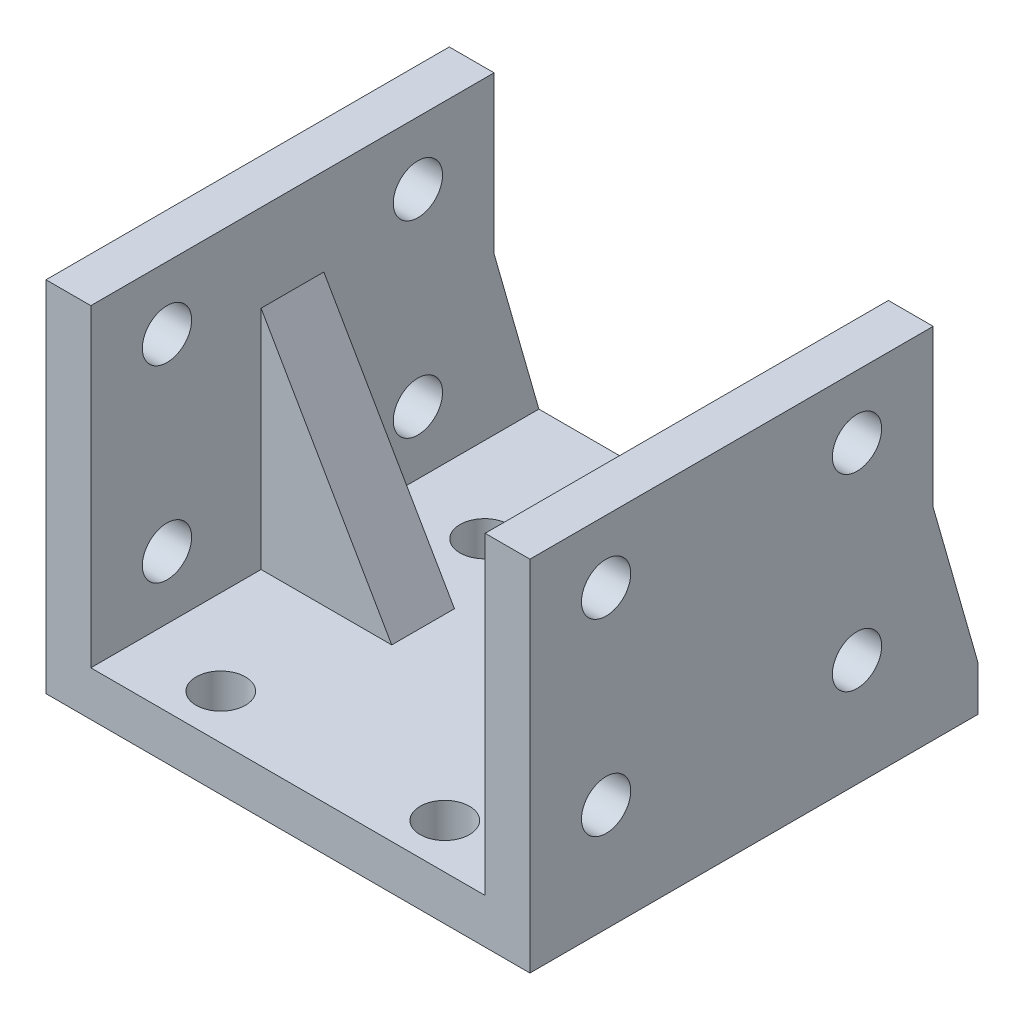
from build123d import *

# Parameters (mm, degrees)
SKETCH1_W               = 54
SKETCH1_H               = 55
BOSS_EXTRUDE1_DEPTH     = 5
SKETCH6_W               = 5
SKETCH6_H               = 45
BOSS_EXTRUDE3_DEPTH     = 35
SKETCH7_R               = 2.75
CUT_EXTRUDE2_DEPTH      = 69.972820734
RIB1_REACH              = 74.61
SKETCH8_WALL_W          = 165.420796688
SKETCH8_WALL_H          = 5
MIRROR2_COPY_1_REACH    = 74.61
MIRROR2_COPY_1_SKETCH_W = 165.420796688
MIRROR2_COPY_1_SKETCH_H = 5
RIB4_REACH              = 57.545
SKETCH9_WALL_W          = 142.246242154
SKETCH9_WALL_H          = 7
SKETCH10_R              = 2.75
CUT_EXTRUDE3_DEPTH      = 53.060061468
SKETCH11_W              = 54
SKETCH11_H              = 5
CUT_EXTRUDE4_DEPTH      = 40


with BuildPart() as part:
    # Sketch1 → Boss-Extrude1 (new body)
    with BuildSketch(Plane(origin=(0, 0, 0), x_dir=(1, 0, 0), z_dir=(0, 1, 0))):
        Rectangle(SKETCH1_W, SKETCH1_H)
    extrude(amount=BOSS_EXTRUDE1_DEPTH)

    # Sketch6 → Boss-Extrude3 (add)
    with BuildSketch(Plane(origin=(0, 5, 0), x_dir=(1, 0, 0), z_dir=(0, 1, 0))):
        with Locations((-24.5, 0)):
            Rectangle(SKETCH6_W, SKETCH6_H)
    boss_extrude3 = extrude(amount=BOSS_EXTRUDE3_DEPTH)

    # Sketch7 → Cut-Extrude2 (cut, through all)
    with BuildSketch(Plane(origin=(-22, 0, 0), x_dir=(0, 0, -1), z_dir=(1, 0, 0))):
        with Locations((-14, 33)):
            Circle(SKETCH7_R)
        with Locations((14, 33)):
            Circle(SKETCH7_R)
        with Locations((14, 12)):
            Circle(SKETCH7_R)
        with Locations((-14, 12)):
            Circle(SKETCH7_R)
    cut_extrude2 = extrude(amount=-CUT_EXTRUDE2_DEPTH, mode=Mode.SUBTRACT)

    # Sketch8 wall → Rib1 (add, up to next)
    with BuildSketch(Plane(origin=(-27, 13.75, -25), x_dir=(0, -0.961523947641, -0.274721127897), z_dir=(0, -0.274721127897, 0.961523947641)), mode=Mode.PRIVATE) as rib1_sk1:
        with Locations((0, 2.5)):
            Rectangle(SKETCH8_WALL_W, SKETCH8_WALL_H)
    rib1_tool1 = extrude(rib1_sk1.sketch, amount=RIB1_REACH, mode=Mode.PRIVATE) - part.part
    rib1 = rib1_tool1.solids().sort_by_distance((-27, 13.75, -25))[0]
    add(rib1)

    # Mirror1: Rib1 across plane
    add(rib1.mirror(Plane.XY))

    # Mirror2: Boss-Extrude3, Cut-Extrude2, Rib1 across plane
    add(boss_extrude3.mirror(Plane(origin=(0, 0, 0), x_dir=(0, 0, 1), z_dir=(1, 0, 0))))
    add(cut_extrude2.mirror(Plane(origin=(0, 0, 0), x_dir=(0, 0, 1), z_dir=(1, 0, 0))), mode=Mode.SUBTRACT)
    add(rib1.mirror(Plane(origin=(0, 0, 0), x_dir=(0, 0, 1), z_dir=(1, 0, 0))))

    # Mirror2 copy 1 sketch → Mirror2 copy 1 (add, up to next)
    with BuildSketch(Plane(origin=(27, 13.75, 25), x_dir=(0, -0.961523947641, 0.274721127897), z_dir=(0, -0.274721127897, -0.961523947641)), mode=Mode.PRIVATE) as mirror2_copy_1_sk1:
        with Locations((0, 2.5)):
            Rectangle(MIRROR2_COPY_1_SKETCH_W, MIRROR2_COPY_1_SKETCH_H)
    mirror2_copy_1_tool1 = extrude(mirror2_copy_1_sk1.sketch, amount=MIRROR2_COPY_1_REACH, mode=Mode.PRIVATE) - part.part
    add(mirror2_copy_1_tool1.solids().sort_by_distance((27, 13.75, 25))[0])

    # Sketch9 wall → Rib4 (add, up to next)
    with BuildSketch(Plane(origin=(-14.710952852, 17.625, 0), x_dir=(0.499999999999, -0.866025403785, 0), z_dir=(0.866025403785, 0.499999999999, 0)), mode=Mode.PRIVATE) as rib4_sk1:
        Rectangle(SKETCH9_WALL_W, SKETCH9_WALL_H)
    rib4_tool1 = extrude(rib4_sk1.sketch, amount=-RIB4_REACH, mode=Mode.PRIVATE) - part.part
    rib4 = rib4_tool1.solids().sort_by_distance((-14.710952852, 17.625, 0))[0]
    add(rib4)

    # Mirror3: Rib4 across plane
    add(rib4.mirror(Plane(origin=(0, 0, 0), x_dir=(0, 0, 1), z_dir=(1, 0, 0))))

    # Sketch10 → Cut-Extrude3 (cut, through all)
    with BuildSketch(Plane(origin=(0, 5, 0), x_dir=(1, 0, 0), z_dir=(0, 1, 0))):
        with Locations(Location((12.5, 11.943211227, 0), (0, 0, 270))):
            Circle(SKETCH10_R)
        with Locations(Location((12.5, -17.5, 0), (0, 0, 270))):
            Circle(SKETCH10_R)
        with Locations(Location((-12.5, -17.5, 0), (0, 0, 270))):
            Circle(SKETCH10_R)
        with Locations(Location((-12.5, 11.943211227, 0), (0, 0, 270))):
            Circle(SKETCH10_R)
    extrude(amount=-CUT_EXTRUDE3_DEPTH, mode=Mode.SUBTRACT)

    # Sketch11 → Cut-Extrude4 (cut)
    with BuildSketch(Plane.XZ):
        with Locations((0, 25)):
            Rectangle(SKETCH11_W, SKETCH11_H)
    extrude(amount=-CUT_EXTRUDE4_DEPTH, mode=Mode.SUBTRACT)


solid = part.part
